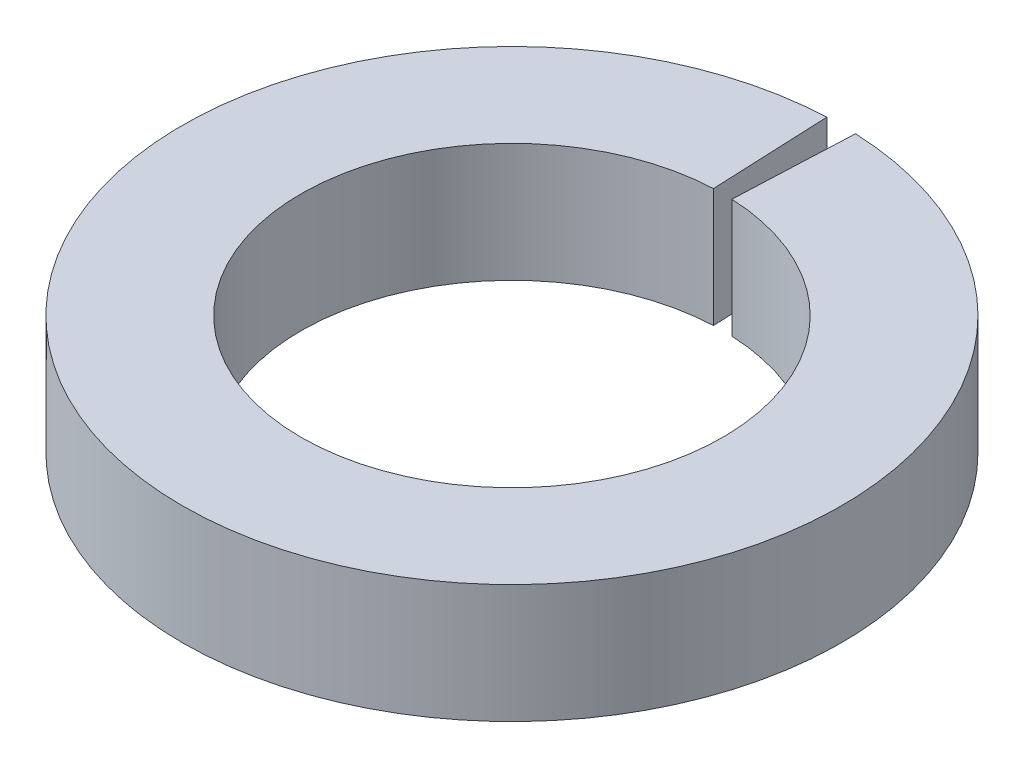
from build123d import *

# Parameters (mm, degrees)
BOSS_EXTRUDE1_DEPTH = 0.9


with BuildPart() as part:
    # Sketch1 → Boss-Extrude1 (new body)
    with BuildSketch(Plane(origin=(0, 0, 0), x_dir=(1, 0, 0), z_dir=(0, 1, 0))):
        with BuildLine():
            Line((-0.06979102, 1.598477155), (-0.109048468, 2.497620554))
            ThreePointArc((-0.109048468, 2.497620554), (0, -2.5), (0.109048468, 2.497620554))
            Line((0.109048468, 2.497620554), (0.06979102, 1.598477155))
            ThreePointArc((0.06979102, 1.598477155), (0, -1.6), (-0.06979102, 1.598477155))
        make_face()
    extrude(amount=BOSS_EXTRUDE1_DEPTH)


solid = part.part
